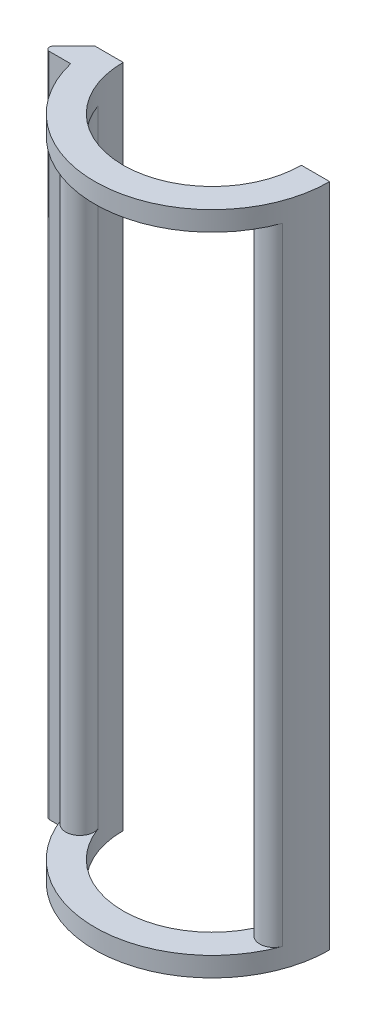
from build123d import *

# Parameters (mm, degrees)
BOSS_EXTRUDE1_DEPTH = 215.9
FILLET2_R           = 1.27
CUT_EXTRUDE2_START  = 6.35
CUT_EXTRUDE2_DEPTH  = 203.2


with BuildPart() as part:
    # Sketch4 → Boss-Extrude1 (new body)
    with BuildSketch(Plane(origin=(0, 0, 0), x_dir=(1, 0, 0), z_dir=(0, 1, 0))):
        with BuildLine():
            Line((-28.9052, 0), (-38.1, 0))
            Line((-38.1, 0), (-46.99, -8.89))
            Line((-46.99, -8.89), (-38.1, -8.89))
            Line((-38.1, -8.89), (-37.04831845, -8.89))
            ThreePointArc((-37.04831845, -8.89), (4.475995255, -37.836166118), (38.1, 0))
            Line((38.1, 0), (28.9052, 0))
            ThreePointArc((28.9052, 0), (0, -28.9052), (-28.9052, 0))
        make_face()
    extrude(amount=BOSS_EXTRUDE1_DEPTH)

    # Fillet2
    fillet2_edges = [part.edges().sort_by_distance(p)[0] for p in [
        (-46.99, 107.95, 8.89),
    ]]
    fillet(fillet2_edges, radius=FILLET2_R)

    # Sketch6 → Cut-Extrude2 (cut)
    with BuildSketch(Plane(origin=(0, 0, 0), x_dir=(1, 0, 0), z_dir=(0, 1, 0)).offset(CUT_EXTRUDE2_START)):
        with BuildLine():
            ThreePointArc((-35.802288852, -13.030967461), (0, -38.1), (35.802288852, -13.030967461))
            ThreePointArc((35.802288852, -13.030967461), (29.90974259, -15.778706909), (27.162003142, -9.886160647))
            ThreePointArc((27.162003142, -9.886160647), (0, -28.9052), (-27.162003142, -9.886160647))
            ThreePointArc((-27.162003142, -9.886160647), (-29.90974259, -15.778706909), (-35.802288852, -13.030967461))
        make_face()
    extrude(amount=CUT_EXTRUDE2_DEPTH, mode=Mode.SUBTRACT)


solid = part.part
